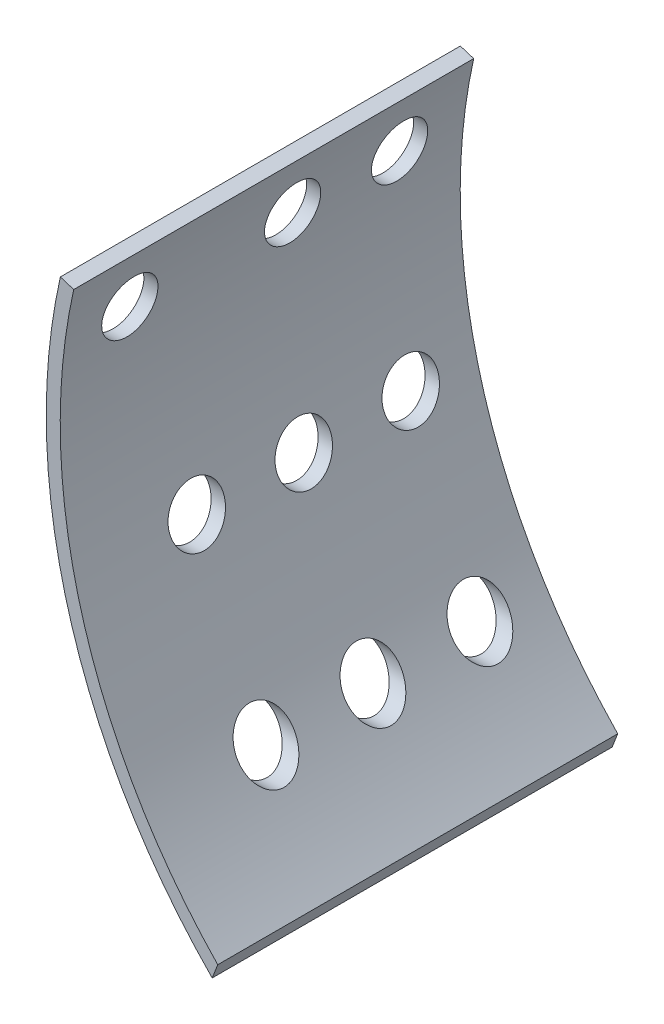
from build123d import *

# Parameters (mm, degrees)
Y_KSEKLIK_EKSTR_ZYON1_DEPTH = 430
SKETCH1_R                   = 30
CUT_EXTRUDE3_DEPTH          = 3488.710186126


with BuildPart() as part:
    # Model → Yükseklik-Ekstrüzyon1 (new body)
    with BuildSketch(Plane.XY):
        with BuildLine():
            Line((2607.289962224, 2081.125921535), (2592.933230394, 2085.655003204))
            ThreePointArc((2592.933230394, 2085.655003204), (2601.606281591, 1779.263260456), (2756.139118134, 1514.554506783))
            Line((2756.139118134, 1514.554506783), (2762.112515814, 1529.91304418))
            ThreePointArc((2762.112515814, 1529.91304418), (2615.281961656, 1786.021263147), (2607.289962224, 2081.125921535))
        make_face()
    extrude(amount=Y_KSEKLIK_EKSTR_ZYON1_DEPTH)

    # Sketch1 → Cut-Extrude3 (cut, through all)
    with BuildSketch(Plane(origin=(0, 0, 0), x_dir=(0, 0, -1), z_dir=(1, 0, 0))):
        with Locations(Location((-185, 2025.655003204, 0), (0, 0, 180))):
            Circle(SKETCH1_R)
        with Locations(Location((-360, 2025.655003204, 0), (0, 0, 180))):
            Circle(SKETCH1_R)
        with Locations(Location((-70, 2025.655003204, 0), (0, 0, 180))):
            Circle(SKETCH1_R)
        with Locations(Location((-300, 1808.152676247, 0), (0, 0, 180))):
            Circle(SKETCH1_R)
        with Locations(Location((-185, 1808.152676247, 0), (0, 0, 180))):
            Circle(SKETCH1_R)
        with Locations(Location((-70, 1808.152676247, 0), (0, 0, 180))):
            Circle(SKETCH1_R)
        with Locations(Location((-300, 1630.762196714, 0), (0, 0, 180))):
            Circle(SKETCH1_R)
        with Locations(Location((-185, 1630.762196714, 0), (0, 0, 180))):
            Circle(SKETCH1_R)
        with Locations(Location((-70, 1630.762196714, 0), (0, 0, 180))):
            Circle(SKETCH1_R)
    extrude(amount=CUT_EXTRUDE3_DEPTH, mode=Mode.SUBTRACT)


solid = part.part
